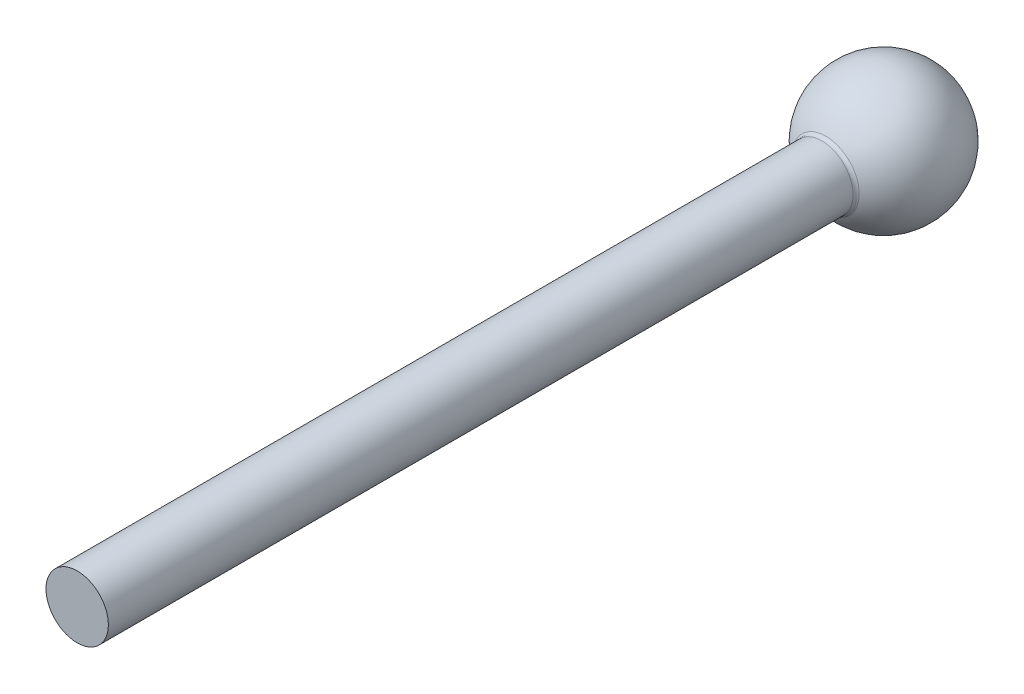
from build123d import *

# Parameters (mm, degrees)
ESBO_O1_R                = 3.5
RESSALTO_EXTRUS_O1_DEPTH = 85
FILETE1_R                = 0.5


with BuildPart() as part:
    # Esboço1 → Ressalto-extrusão1 (new body)
    with BuildSketch(Plane.XY):
        Circle(ESBO_O1_R)
    extrude(amount=RESSALTO_EXTRUS_O1_DEPTH)

    # Esboço2 → Revolução7 (revolve)
    with BuildSketch(Plane(origin=(0, 0, 0), x_dir=(1, 0, 0), z_dir=(0, 1, 0))):
        with BuildLine():
            Line((0, 13), (0, -2))
            ThreePointArc((0, -2), (-7.5, 5.5), (0, 13))
        make_face()
    revolve(axis=Axis((0, 0, -13), (0, 0, 1)))

    # Filete1
    filete1_edges = [part.edges().sort_by_distance(p)[0] for p in [
        (0, 3.5, 1.133249581),
    ]]
    fillet(filete1_edges, radius=FILETE1_R)


solid = part.part
